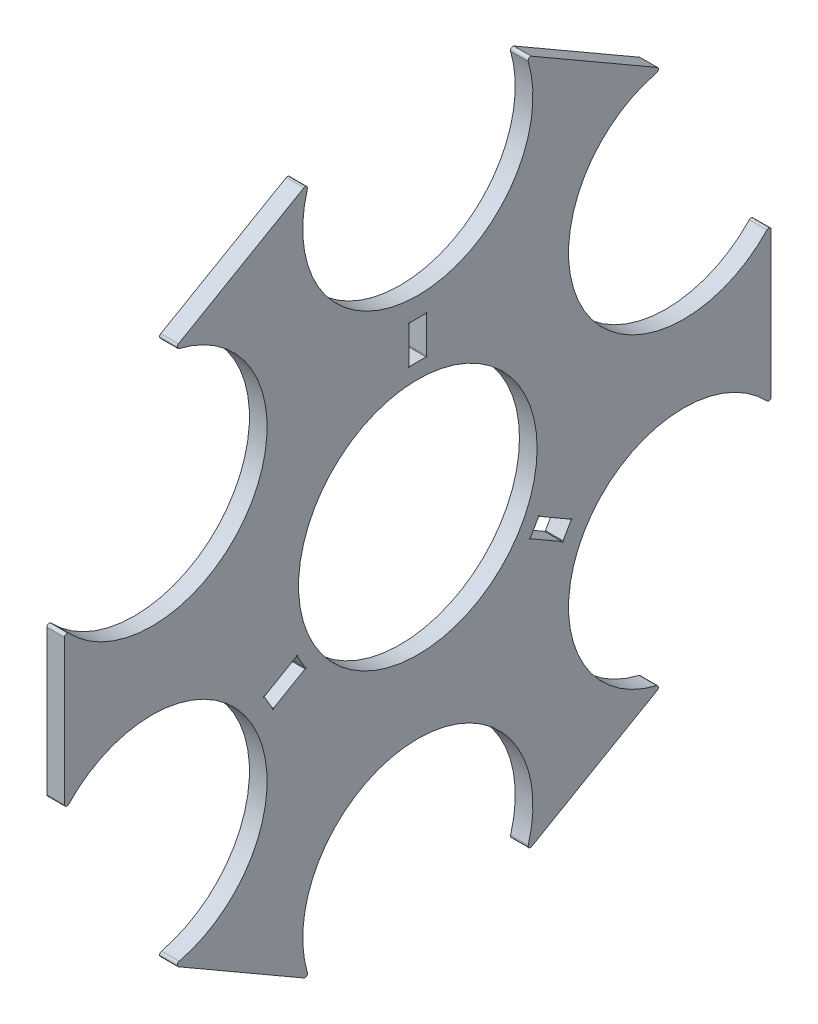
from build123d import *

# Parameters (mm, degrees)
SKETCH2_R           = 39.487475
BOSS_EXTRUDE1_DEPTH = 5.842
FILLET1_R           = 0.79375
SKETCH4_W           = 5.742
SKETCH4_H           = 12.5
CUT_EXTRUDE3_DEPTH  = 163.986308211
SKETCH5_R           = 0.1984375
CUT_EXTRUDE4_DEPTH  = 163.986308211


with BuildPart() as part:
    # Sketch2 → Boss-Extrude1 (new body)
    with BuildSketch(Plane(origin=(0, 0, 0), x_dir=(0, 0, -1), z_dir=(1, 0, 0))):
        with BuildLine():
            Line((81.02619141, 88.258519733), (35.921024484, 114.3))
            ThreePointArc((35.921024484, 114.3), (0, 63.5), (-35.921024484, 114.3))
            Line((-35.921024484, 114.3), (-81.02619141, 88.258519733))
            ThreePointArc((-81.02619141, 88.258519733), (-54.99261314, 31.75), (-116.947215895, 26.041480267))
            Line((-116.947215895, 26.041480267), (-116.947215895, -26.041480267))
            ThreePointArc((-116.947215895, -26.041480267), (-54.99261314, -31.75), (-81.02619141, -88.258519733))
            Line((-81.02619141, -88.258519733), (-35.921024484, -114.3))
            ThreePointArc((-35.921024484, -114.3), (0, -63.5), (35.921024484, -114.3))
            Line((35.921024484, -114.3), (81.02619141, -88.258519733))
            ThreePointArc((81.02619141, -88.258519733), (54.99261314, -31.75), (116.947215895, -26.041480267))
            Line((116.947215895, -26.041480267), (116.947215895, 26.041480267))
            ThreePointArc((116.947215895, 26.041480267), (54.99261314, 31.75), (81.02619141, 88.258519733))
        make_face()
        Circle(SKETCH2_R, mode=Mode.SUBTRACT)
    extrude(amount=BOSS_EXTRUDE1_DEPTH)

    # Fillet1
    fillet1_edges = [part.edges().sort_by_distance(p)[0] for p in [
        (2.921, 88.258519733, 81.02619141),
        (2.921, 114.3, 35.921024484),
        (2.921, 114.3, -35.921024484),
        (2.921, 88.258519733, -81.02619141),
        (2.921, 26.041480267, -116.947215895),
        (2.921, -26.041480267, -116.947215895),
        (2.921, -88.258519733, -81.02619141),
        (2.921, -114.3, -35.921024484),
        (2.921, -114.3, 35.921024484),
        (2.921, -88.258519733, 81.02619141),
        (2.921, -26.041480267, 116.947215895),
        (2.921, 26.041480267, 116.947215895),
    ]]
    fillet(fillet1_edges, radius=FILLET1_R)

    # Sketch4 → Cut-Extrude3 (cut, through all)
    with BuildSketch(Plane(origin=(5.842, 0, 0), x_dir=(0, 0, -1), z_dir=(1, 0, 0))):
        Polygon((47.971249286, -31.011358934), (50.842249286, -26.038641066), (40.016931739, -19.788641066), (37.145931739, -24.761358934), align=None)
        with Locations((0, 50.8)):
            Rectangle(SKETCH4_W, SKETCH4_H)
        Polygon((-50.842249286, -26.038641066), (-47.971249286, -31.011358934), (-37.145931739, -24.761358934), (-40.016931739, -19.788641066), align=None)
    extrude(amount=-CUT_EXTRUDE3_DEPTH, mode=Mode.SUBTRACT)

    # Sketch5 → Cut-Extrude4 (cut, through all)
    with BuildSketch(Plane(origin=(5.842, 0, 0), x_dir=(0, 0, -1), z_dir=(1, 0, 0))):
        with Locations((2.871, 57.05)):
            Circle(SKETCH5_R)
        with Locations((-2.871, 57.05)):
            Circle(SKETCH5_R)
        with Locations((-2.871, 44.55)):
            Circle(SKETCH5_R)
        with Locations((2.871, 44.55)):
            Circle(SKETCH5_R)
        with Locations((47.971249286, -31.011358934)):
            Circle(SKETCH5_R)
        with Locations((50.842249286, -26.038641066)):
            Circle(SKETCH5_R)
        with Locations((40.016931739, -19.788641066)):
            Circle(SKETCH5_R)
        with Locations((37.145931739, -24.761358934)):
            Circle(SKETCH5_R)
        with Locations((-50.842249286, -26.038641066)):
            Circle(SKETCH5_R)
        with Locations((-47.971249286, -31.011358934)):
            Circle(SKETCH5_R)
        with Locations((-37.145931739, -24.761358934)):
            Circle(SKETCH5_R)
        with Locations((-40.016931739, -19.788641066)):
            Circle(SKETCH5_R)
    extrude(amount=-CUT_EXTRUDE4_DEPTH, mode=Mode.SUBTRACT)


solid = part.part
